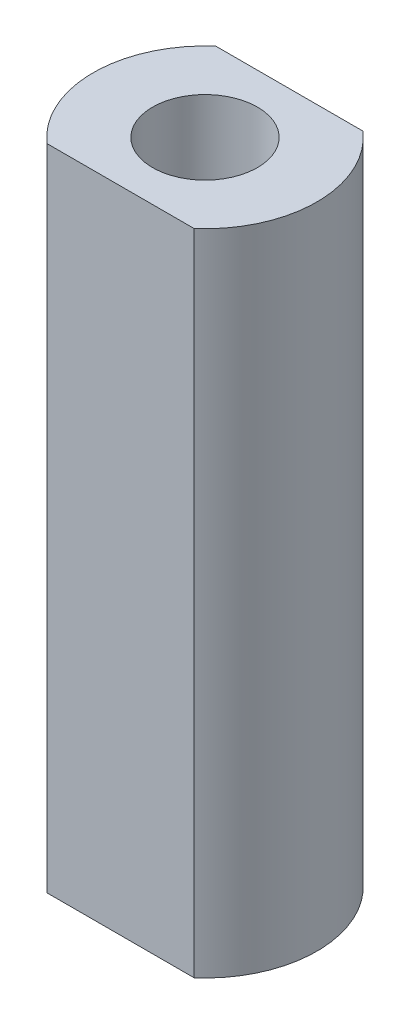
from build123d import *

# Parameters (mm, degrees)
SKETCH_1_R             = 20.7
SKETCH_1_R_2           = 9.7
EXTRUDE_1_DEPTH        = 109.5
EXTRUDE_1_2_DEPTH      = 10
EXTRUDE_1_2_DEPTH_BACK = 1
SKETCH_2_W             = 45.579766756
SKETCH_2_H             = 31.21486686
SKETCH_3_R             = 9.7
CUT_EXTRUDE_1_DEPTH    = 124.886515749
SKETCH_4_W             = 48.064833826
SKETCH_4_H             = 7.030921468
CUT_EXTRUDE_2_DEPTH    = 114.745851724
SKETCH_5_R             = 31.7
SKETCH_5_R_2           = 20.7
CUT_EXTRUDE_1_2_DEPTH  = 124.886515749


with BuildPart() as part:
    # 草圖1 → Extrude 1 (new body)
    with BuildSketch(Plane(origin=(0, 0, 0), x_dir=(1, 0, 0), z_dir=(0, 1, 0))):
        Circle(SKETCH_1_R)
        Circle(SKETCH_1_R_2, mode=Mode.SUBTRACT)
    extrude(amount=EXTRUDE_1_DEPTH)

    # 草圖2 → Extrude 1 2 (add, two sides: drawn at the far end of the back side and taken through both)
    with BuildSketch(Plane(origin=(0, 110, 0), x_dir=(1, 0, 0), z_dir=(0, 1, 0)).offset(-EXTRUDE_1_2_DEPTH_BACK)):
        Rectangle(SKETCH_2_W, SKETCH_2_H)
    extrude(amount=EXTRUDE_1_2_DEPTH + EXTRUDE_1_2_DEPTH_BACK)

    # 草圖3 → Cut-Extrude 1 (cut, through all)
    with BuildSketch(Plane.XZ):
        with Locations(Location((0, 0, 0), (0, 0, 270))):
            Circle(SKETCH_3_R)
    extrude(amount=-CUT_EXTRUDE_1_DEPTH, mode=Mode.SUBTRACT)

    # 草圖4 → 除料-伸長2 (cut, through all)
    with BuildSketch(Plane(origin=(0, 109.5, 0), x_dir=(1, 0, 0), z_dir=(0, 1, 0))):
        with Locations((1.242533535, -19.122894164)):
            Rectangle(SKETCH_4_W, SKETCH_4_H)
    extrude(amount=-CUT_EXTRUDE_2_DEPTH, mode=Mode.SUBTRACT)

    # 草圖5 → Cut-Extrude 1 2 (cut, through all)
    with BuildSketch(Plane.XZ):
        Circle(SKETCH_5_R)
        Circle(SKETCH_5_R_2, mode=Mode.SUBTRACT)
    extrude(amount=-CUT_EXTRUDE_1_2_DEPTH, mode=Mode.SUBTRACT)


solid = part.part
